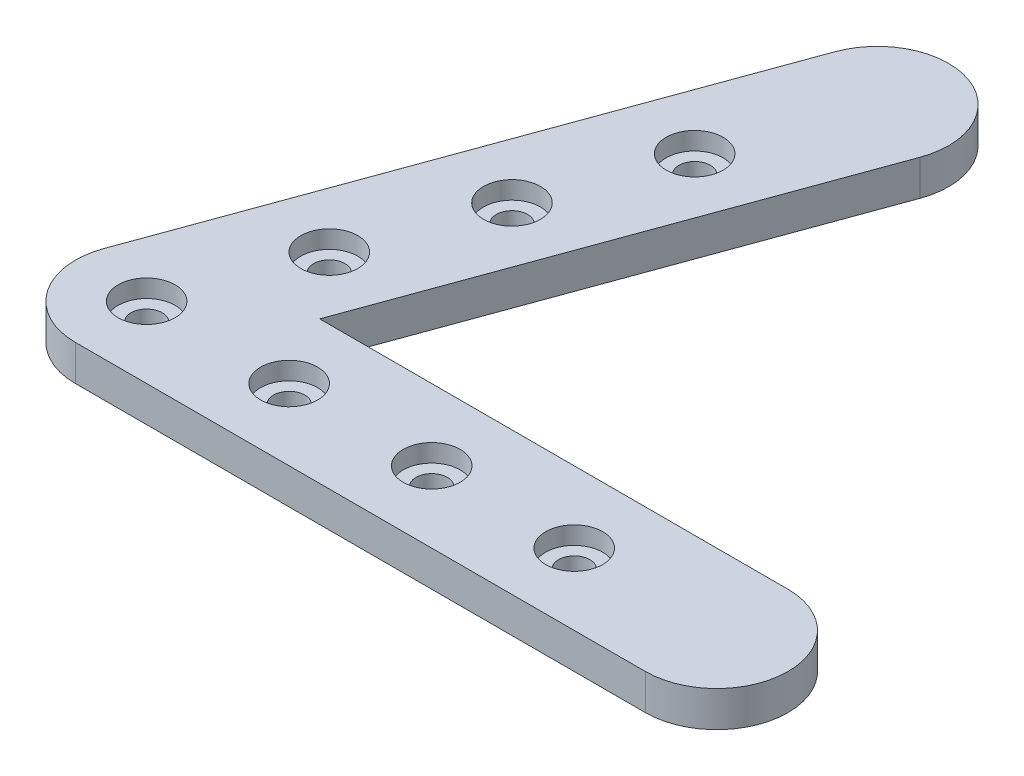
from build123d import *

# Parameters (mm, degrees)
SKETCH5_R            = 2.794
BOSS_EXTRUDE21_DEPTH = 6.35
SKETCH6_R            = 2.794
CUT_EXTRUDE3_DEPTH   = 6.35
SKETCH7_R            = 5.08
CUT_EXTRUDE4_DEPTH   = 3.175


with BuildPart() as part:
    # Sketch5 → Boss-Extrude21 (new body)
    # profile 1 of 3: a face of its own
    with BuildSketch(Plane(origin=(0, 0, 0), x_dir=(1, 0, 0), z_dir=(0, 1, 0))):
        with BuildLine():
            Line((101.6, 12.7), (18.137479686, 12.7))
            Line((18.137479686, 12.7), (11.934096284, -4.34365582))
            ThreePointArc((11.934096284, -4.34365582), (7.284420742, -10.403230962), (0, -12.7))
            Line((0, -12.7), (101.6, -12.7))
            ThreePointArc((101.6, -12.7), (114.3, 0), (101.6, 12.7))
        make_face()
    # profile 2 of 3: a face of its own
    with BuildSketch(Plane(origin=(0, 0, 0), x_dir=(1, 0, 0), z_dir=(0, 1, 0))):
        with BuildLine():
            ThreePointArc((-11.934096284, 4.34365582), (-7.284420742, 10.403230962), (0, 12.7))
            Line((0, 12.7), (18.137479686, 12.7))
            Line((18.137479686, 12.7), (46.683342846, 91.129114452))
            ThreePointArc((46.683342846, 91.129114452), (39.092902382, 107.406866556), (22.815150278, 99.816426092))
            Line((22.815150278, 99.816426092), (-11.934096284, 4.34365582))
        make_face()
    # profile 3 of 3: a face of its own
    with BuildSketch(Plane(origin=(0, 0, 0), x_dir=(1, 0, 0), z_dir=(0, 1, 0))):
        with BuildLine():
            Line((18.137479686, 12.7), (0, 12.7))
            ThreePointArc((0, 12.7), (-7.284420742, 10.403230962), (-11.934096284, 4.34365582))
            ThreePointArc((-11.934096284, 4.34365582), (-10.403230962, -7.284420742), (0, -12.7))
            ThreePointArc((0, -12.7), (7.284420742, -10.403230962), (11.934096284, -4.34365582))
            Line((11.934096284, -4.34365582), (18.137479686, 12.7))
        make_face()
        with Locations(Location((0, 0, 0), (0, 0, 270))):
            Circle(SKETCH5_R, mode=Mode.SUBTRACT)
    extrude(amount=BOSS_EXTRUDE21_DEPTH)

    # Sketch6 → Cut-Extrude3 (cut)
    with BuildSketch(Plane(origin=(0, 0, 0), x_dir=(-1, 0, 0), z_dir=(0, -1, 0))):
        with Locations(Location((-50.8, 0, 0), (0, 0, 90))):
            Circle(SKETCH6_R)
        with Locations(Location((-17.374623281, 47.736385136, 0), (0, 0, 90))):
            Circle(SKETCH6_R)
        with Locations(Location((-25.4, 0, 0), (0, 0, 90))):
            Circle(SKETCH6_R)
        with Locations(Location((-76.2, 0, 0), (0, 0, 90))):
            Circle(SKETCH6_R)
        with Locations(Location((-8.68731164, 23.868192568, 0), (0, 0, 90))):
            Circle(SKETCH6_R)
        with Locations(Location((-26.061934921, 71.604577704, 0), (0, 0, 90))):
            Circle(SKETCH6_R)
    extrude(amount=-CUT_EXTRUDE3_DEPTH, mode=Mode.SUBTRACT)

    # Sketch7 → Cut-Extrude4 (cut)
    with BuildSketch(Plane(origin=(0, 6.35, 0), x_dir=(1, 0, 0), z_dir=(0, 1, 0))):
        with Locations(Location((26.061934921, 71.604577704, 0), (0, 0, 270))):
            Circle(SKETCH7_R)
        with Locations(Location((17.374623281, 47.736385136, 0), (0, 0, 270))):
            Circle(SKETCH7_R)
        with Locations(Location((8.68731164, 23.868192568, 0), (0, 0, 270))):
            Circle(SKETCH7_R)
        with Locations(Location((0, 0, 0), (0, 0, 270))):
            Circle(SKETCH7_R)
        with Locations(Location((25.4, 0, 0), (0, 0, 270))):
            Circle(SKETCH7_R)
        with Locations(Location((50.8, 0, 0), (0, 0, 270))):
            Circle(SKETCH7_R)
        with Locations(Location((76.2, 0, 0), (0, 0, 270))):
            Circle(SKETCH7_R)
    extrude(amount=-CUT_EXTRUDE4_DEPTH, mode=Mode.SUBTRACT)


solid = part.part
